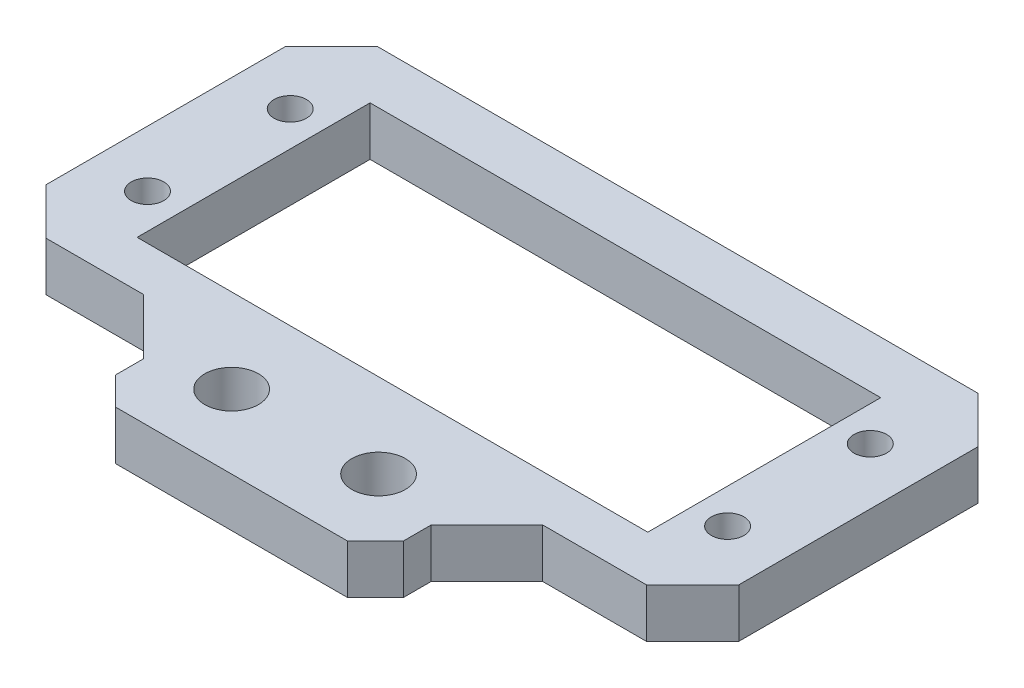
from build123d import *

# Parameters (mm, degrees)
SKETCH1_R           = 2.1082
SKETCH1_R_2         = 3.475
SKETCH1_W           = 66.2
SKETCH1_H           = 30.2
BOSS_EXTRUDE1_DEPTH = 6.35


with BuildPart() as part:
    # Sketch1 → Boss-Extrude1 (new body)
    with BuildSketch(Plane(origin=(0, 0, 0), x_dir=(1, 0, 0), z_dir=(0, 1, 0))):
        Polygon((59.986534985, 21.9), (-17.836534985, 21.9), (-23.836534985, 15.9), (-23.836534985, -15.1), (-17.836534985, -21.1), (-5.201359875, -21.1), (2.025, -28.326359875), (2.025, -31.939539813), (5.638179938, -35.55271975), (35.711820062, -35.55271975), (39.325, -31.939539813), (39.325, -28.326359875), (46.551359875, -21.1), (59.986534985, -21.1), (65.986534985, -15.1), (65.986534985, 15.9), align=None)
        with Locations(Location((58.675, 9.25, 0), (0, 0, 270))):
            Circle(SKETCH1_R, mode=Mode.SUBTRACT)
        with Locations(Location((58.675, -9.25, 0), (0, 0, 90))):
            Circle(SKETCH1_R, mode=Mode.SUBTRACT)
        with Locations(Location((-16.525, -9.25, 0), (0, 0, 270))):
            Circle(SKETCH1_R, mode=Mode.SUBTRACT)
        with Locations(Location((-16.525, 9.25, 0), (0, 0, 90))):
            Circle(SKETCH1_R, mode=Mode.SUBTRACT)
        with Locations(Location((11.15, -26.022, 0), (0, 0, 270))):
            Circle(SKETCH1_R_2, mode=Mode.SUBTRACT)
        with Locations(Location((30.2, -26.022, 0), (0, 0, 90))):
            Circle(SKETCH1_R_2, mode=Mode.SUBTRACT)
        with Locations((21.075, 0)):
            Rectangle(SKETCH1_W, SKETCH1_H, mode=Mode.SUBTRACT)
    extrude(amount=BOSS_EXTRUDE1_DEPTH)


solid = part.part
